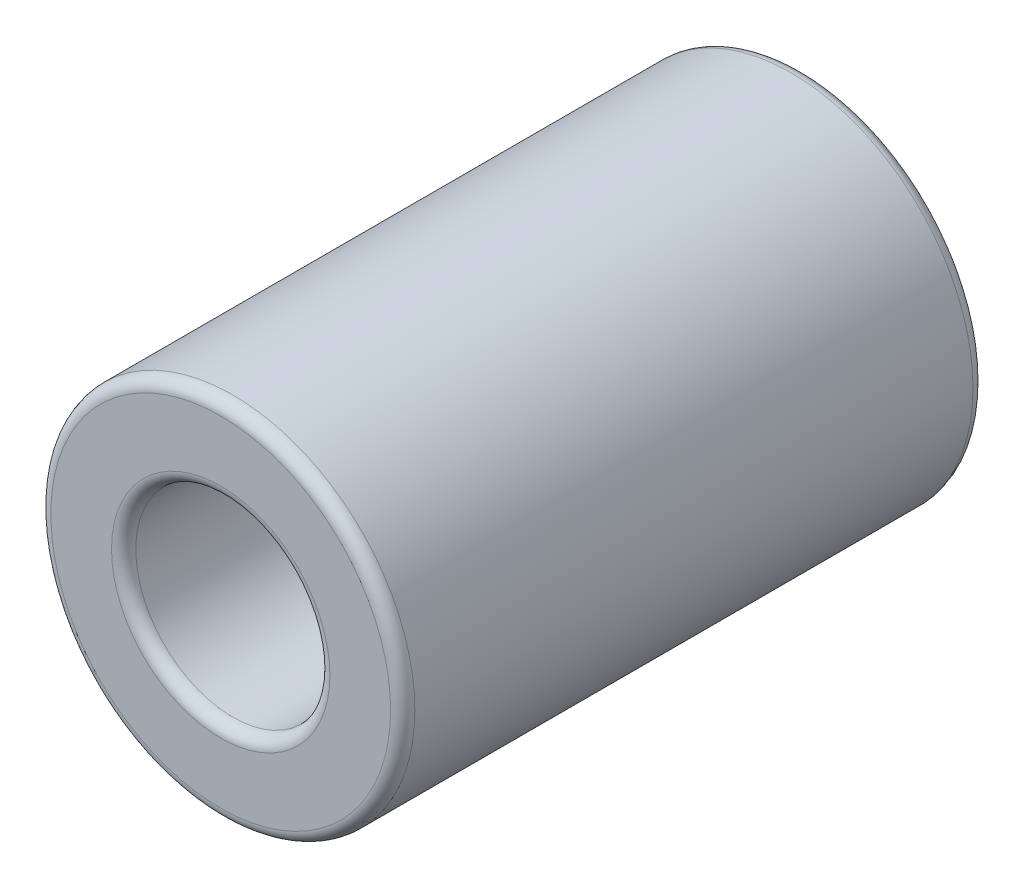
from build123d import *

# Parameters (mm, degrees)
SKETCH_1_R      = 7.5
SKETCH_1_R_2    = 4
EXTRUDE_1_DEPTH = 24
FILLET_1_R      = 0.5


with BuildPart() as part:
    # 草图1 → 凸台-拉伸1 (new body)
    with BuildSketch(Plane.XY):
        Circle(SKETCH_1_R)
        Circle(SKETCH_1_R_2, mode=Mode.SUBTRACT)
    extrude(amount=EXTRUDE_1_DEPTH)

    # 圆角1
    fillet_1_edges = [part.edges().sort_by_distance(p)[0] for p in [
        (-7.5, 0, 0),
        (-7.5, 0, 24),
        (-4, 0, 0),
        (-4, 0, 24),
    ]]
    fillet(fillet_1_edges, radius=FILLET_1_R)


solid = part.part
